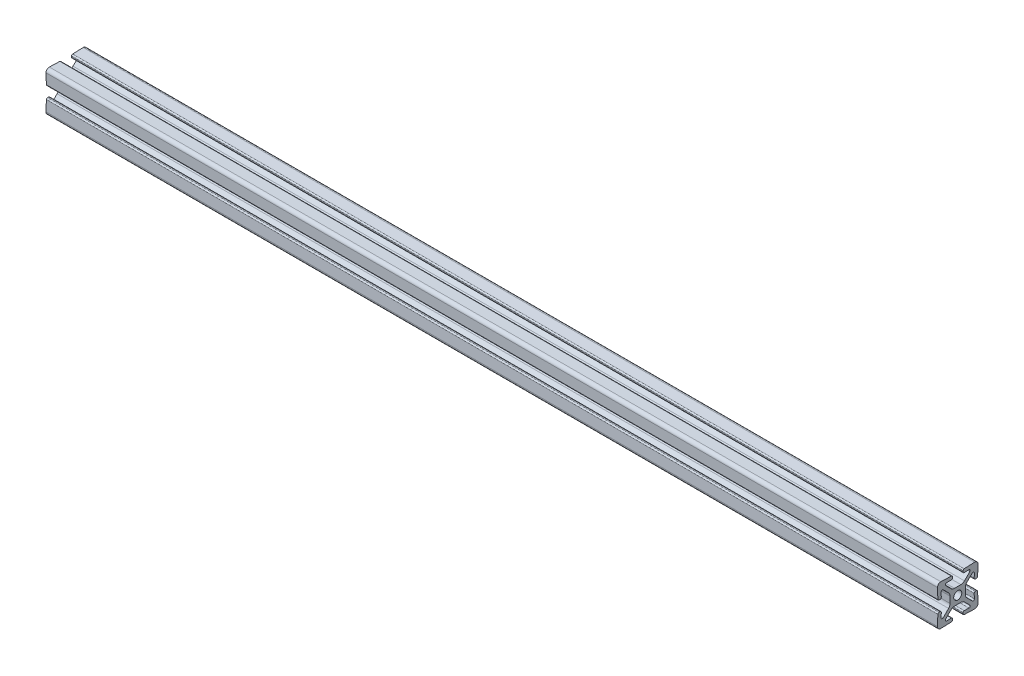
from build123d import *

# Parameters (mm, degrees)
BOSS_EXTRUDE1_DEPTH      = 279.4
BOSS_EXTRUDE1_DEPTH_BACK = 279.4


with BuildPart() as part:
    # Sketch3 → Boss-Extrude1 (new, two sides: drawn at the far end of the back side and taken through both)
    with BuildSketch(Plane(origin=(0, 0, 0), x_dir=(0, 0, -1), z_dir=(1, 0, 0)).offset(-BOSS_EXTRUDE1_DEPTH_BACK)):
        with BuildLine():
            Line((0, 4.826), (1.984228399, 4.826))
            ThreePointArc((1.984228399, 4.826), (3.199248297, 5.067682484), (4.229292429, 5.75593597))
            Line((4.229292429, 5.75593597), (7.586577723, 9.113221264))
            ThreePointArc((7.586577723, 9.113221264), (7.746562132, 9.955883421), (7.021168939, 10.413572441))
            Line((7.021168939, 10.413572441), (4.090593416, 10.311234489))
            ThreePointArc((4.090593416, 10.311234489), (3.534670322, 10.524633371), (3.302, 11.072770299))
            Line((3.302, 11.072770299), (3.302, 11.70815736))
            ThreePointArc((3.302, 11.70815736), (3.515863072, 12.237487038), (4.037406584, 12.46969317))
            Line((4.037406584, 12.46969317), (10.597084223, 12.698762161))
            ThreePointArc((10.597084223, 12.698762161), (12.104840979, 12.104840979), (12.698762161, 10.597084223))
            Line((12.698762161, 10.597084223), (12.46969317, 4.037406584))
            ThreePointArc((12.46969317, 4.037406584), (12.237487038, 3.515863072), (11.70815736, 3.302))
            Line((11.70815736, 3.302), (11.072770299, 3.302))
            ThreePointArc((11.072770299, 3.302), (10.524633371, 3.534670322), (10.311234489, 4.090593416))
            Line((10.311234489, 4.090593416), (10.413572441, 7.021168939))
            ThreePointArc((10.413572441, 7.021168939), (9.955883421, 7.746562132), (9.113221264, 7.586577723))
            Line((9.113221264, 7.586577723), (5.75593597, 4.229292429))
            ThreePointArc((5.75593597, 4.229292429), (5.067682484, 3.199248297), (4.826, 1.984228399))
            Line((4.826, 1.984228399), (4.826, 0))
            Line((4.826, 0), (2.54, 0))
            ThreePointArc((2.54, 0), (1.796051224, 1.796051224), (0, 2.54))
            Line((0, 2.54), (0, 4.826))
        make_face()
    extrude(amount=BOSS_EXTRUDE1_DEPTH + BOSS_EXTRUDE1_DEPTH_BACK)

    # Mirror1: part across plane


with BuildPart() as part_1:
    add(part.part)
    add(part.part.mirror(Plane.ZX))

    # Mirror2: part across plane


with BuildPart() as part_2:
    add(part_1.part)
    add(part_1.part.mirror(Plane.XY))


solid = part_2.part
